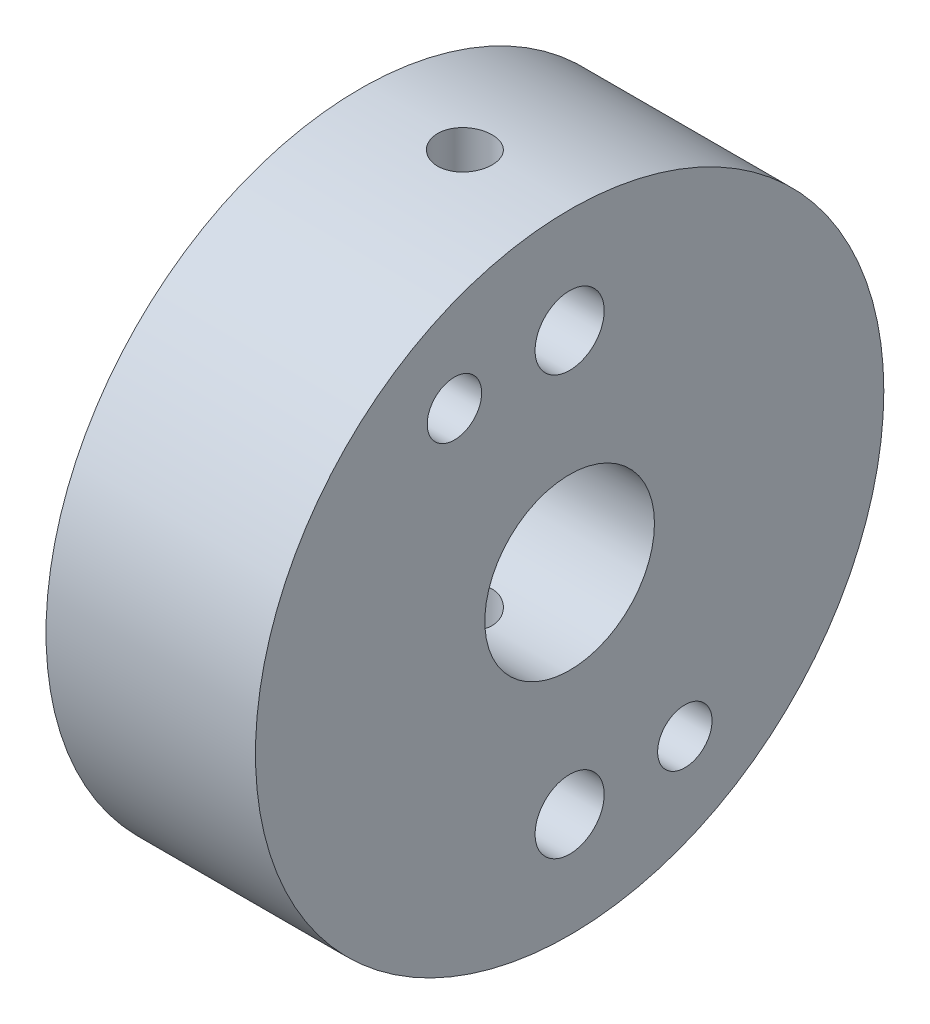
from build123d import *

# Parameters (mm, degrees)
SKETCH_1_R               = 15
SKETCH_1_R_2             = 4.05
EXTRUDE_1_DEPTH          = 10
CUT_EXTRUDE_1_DEPTH      = 24.452078799
CUT_EXTRUDE_1_DEPTH_BACK = 24.452078799
SKETCH_2_R               = 1.3
SKETCH_3_R               = 1.65
SKETCH_3_R_2             = 1.3
CUT_EXTRUDE_2_DEPTH      = 24.452078982


with BuildPart() as part:
    # ｽｹｯﾁ1 → ﾎﾞｽ - 押し出し1 (new body)
    with BuildSketch(Plane(origin=(0, 0, 0), x_dir=(0, 0, -1), z_dir=(1, 0, 0))):
        Circle(SKETCH_1_R)
        Circle(SKETCH_1_R_2, mode=Mode.SUBTRACT)
    extrude(amount=EXTRUDE_1_DEPTH)

    # ｽｹｯﾁ2 → ｶｯﾄ - 押し出し1 (cut, two sides: drawn at the far end of the back side and taken through both)
    with BuildSketch(Plane(origin=(0, 0, 0), x_dir=(1, 0, 0), z_dir=(0, 1, 0)).offset(-CUT_EXTRUDE_1_DEPTH_BACK)):
        with Locations(Location((5, 0, 0), (0, 0, 270))):
            Circle(SKETCH_2_R)
    extrude(amount=CUT_EXTRUDE_1_DEPTH + CUT_EXTRUDE_1_DEPTH_BACK, mode=Mode.SUBTRACT)

    # ｽｹｯﾁ3 → ｶｯﾄ - 押し出し2 (cut, through all)
    with BuildSketch(Plane(origin=(10, 0, 0), x_dir=(0, 0, -1), z_dir=(1, 0, 0))):
        with Locations((0, 10)):
            Circle(SKETCH_3_R)
        with Locations(Location((0, -10, 0), (0, 0, 180))):
            Circle(SKETCH_3_R)
        with Locations((-5.5, 9.526279442)):
            Circle(SKETCH_3_R_2)
        with Locations(Location((5.5, -9.526279442, 0), (0, 0, 180))):
            Circle(SKETCH_3_R_2)
    extrude(amount=-CUT_EXTRUDE_2_DEPTH, mode=Mode.SUBTRACT)


solid = part.part
